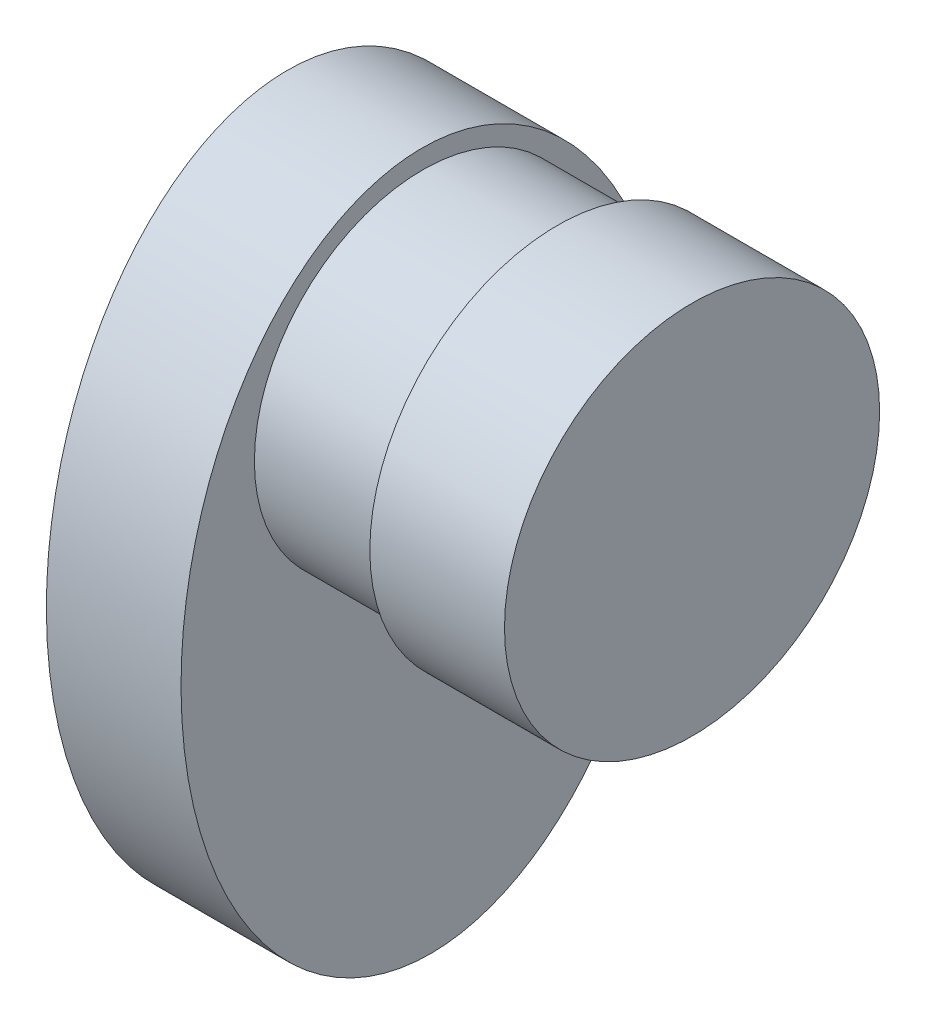
from build123d import *

# Parameters (mm, degrees)
SKETCH1_R           = 495.3
BOSS_EXTRUDE1_DEPTH = 355.6
SKETCH2_R           = 444.5
BOSS_EXTRUDE2_DEPTH = 355.6
SKETCH3_RX          = 927.1
SKETCH3_RY          = 647.7
BOSS_EXTRUDE3_DEPTH = 355.6


with BuildPart() as part:
    # Sketch1 → Boss-Extrude1 (new body)
    with BuildSketch(Plane(origin=(0, 0, 0), x_dir=(0, 0, -1), z_dir=(1, 0, 0))):
        Circle(SKETCH1_R)
    extrude(amount=-BOSS_EXTRUDE1_DEPTH)

    # Sketch2 → Boss-Extrude2 (add)
    with BuildSketch(Plane.ZY.offset(355.6)):
        Circle(SKETCH2_R)
    extrude(amount=BOSS_EXTRUDE2_DEPTH)

    # Sketch3 → Boss-Extrude3 (add)
    with BuildSketch(Plane.ZY.offset(711.2)):
        with Locations(Location((-9.638351828, -431.692416165), (0, 0, -91.279024431))):
            Ellipse(SKETCH3_RX, SKETCH3_RY)
    extrude(amount=BOSS_EXTRUDE3_DEPTH)


solid = part.part
